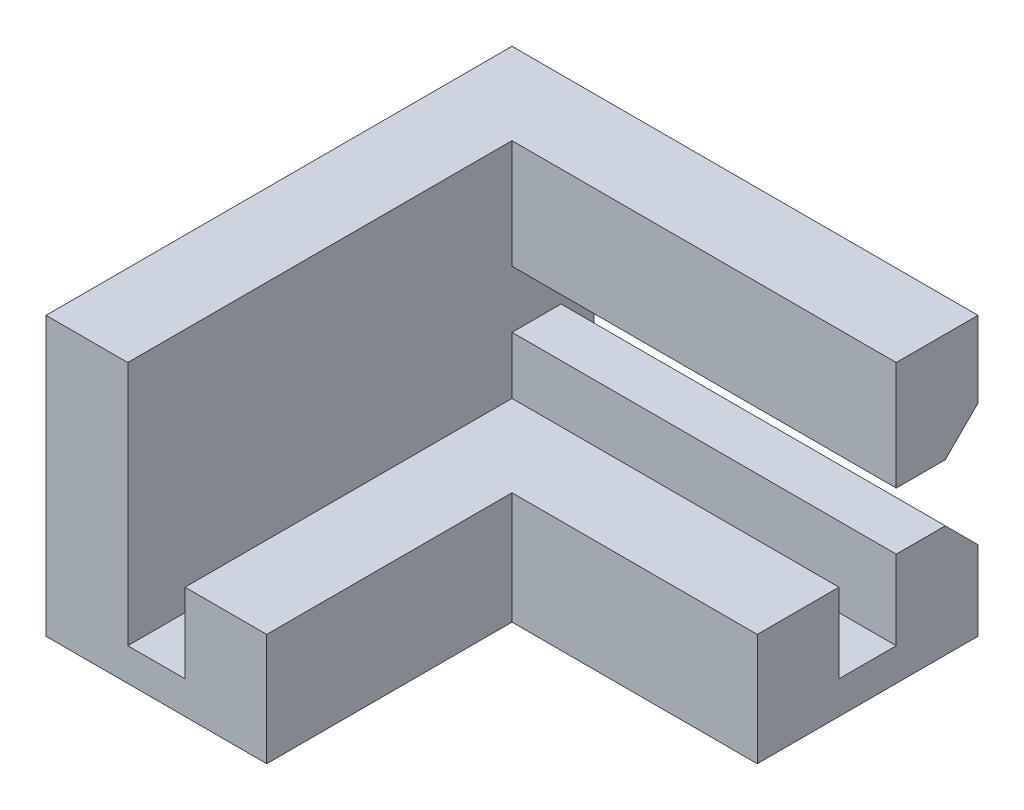
from build123d import *

# Parameters (mm, degrees)
BOSS_EXTRUDE1_DEPTH     = 15
BOSS_EXTRUDE2_DEPTH     = 2
CUT_EXTRUDE1_DEPTH      = 10.15
CUT_EXTRUDE2_DEPTH      = 4.85
CUT_EXTRUDE5_DEPTH      = 37.462309307
CUT_EXTRUDE5_DEPTH_BACK = 37.462309307
CHAMFER3_SIZE           = 2
CUT_EXTRUDE6_DEPTH      = 60.299036748
CUT_EXTRUDE6_DEPTH_BACK = 60.299036748
SKETCH6_W               = 39.703071578
SKETCH6_H               = 42.363425718


with BuildPart() as part:
    # Sketch1 → Boss-Extrude1 (new body)
    with BuildSketch(Plane(origin=(0, 0, 0), x_dir=(1, 0, 0), z_dir=(0, 1, 0))):
        Polygon((23.5, 9.391735838), (-5, 9.391735838), (-5, -4.108264162), (10, -4.108264162), (10, -19.108264162), (23.5, -19.108264162), align=None)
        Polygon((0, 4.391735838), (0, 0.891735838), (15, 0.891735838), (15, -14.108264162), (18.5, -14.108264162), (18.5, 4.391735838), align=None, mode=Mode.SUBTRACT)
    extrude(amount=BOSS_EXTRUDE1_DEPTH)

    # Sketch2 → Boss-Extrude2 (add)
    with BuildSketch(Plane.XZ):
        Polygon((-5, 4.108264162), (10, 4.108264162), (10, 19.108264162), (23.5, 19.108264162), (23.5, -9.391735838), (-5, -9.391735838), align=None)
    extrude(amount=BOSS_EXTRUDE2_DEPTH)

    # Sketch3 → Cut-Extrude1 (cut)
    with BuildSketch(Plane(origin=(0, 15, 0), x_dir=(1, 0, 0), z_dir=(0, 1, 0))):
        Polygon((18.5, 4.391735838), (-5, 4.391735838), (-5, 0.891735838), (-5, -4.108264162), (10, -4.108264162), (10, -19.108264162), (15, -19.108264162), (18.5, -19.108264162), align=None)
    extrude(amount=-CUT_EXTRUDE1_DEPTH, mode=Mode.SUBTRACT)

    # Sketch4 → Cut-Extrude2 (cut)
    with BuildSketch(Plane(origin=(0, 4.85, 0), x_dir=(1, 0, 0), z_dir=(0, 1, 0))):
        Polygon((-5, 4.391735838), (18.5, 4.391735838), (18.5, -19.108264162), (15, -19.108264162), (15, 0.891735838), (-5, 0.891735838), align=None)
    extrude(amount=-CUT_EXTRUDE2_DEPTH, mode=Mode.SUBTRACT)

    # Sketch5 → Cut-Extrude5 (cut, two sides: drawn at the far end of the back side and taken through both)
    with BuildSketch(Plane.XY.offset(-4.391735838).offset(-CUT_EXTRUDE5_DEPTH_BACK)):
        Polygon((-5, 4.85), (18.5, 4.85), (18.5, 8.35), (-10.741212184, 8.35), (-10.741212184, 4.85), align=None)
    extrude(amount=CUT_EXTRUDE5_DEPTH + CUT_EXTRUDE5_DEPTH_BACK, mode=Mode.SUBTRACT)

    # Chamfer3
    chamfer3_edges = [part.edges().sort_by_distance(p)[0] for p in [
        (6.75, 8.35, -9.391735838),
        (6.75, 4.85, -9.391735838),
    ]]
    chamfer(chamfer3_edges, length=CHAMFER3_SIZE)


with BuildPart() as body_2:
    # Mirror1: mirrored copy
    add(part.part.mirror(Plane.ZY.offset(15)))


with BuildPart() as part_1:
    add(part.part)

    # Sketch6 → Cut-Extrude6 (cut, two sides: drawn at the far end of the back side and taken through both)
    with BuildSketch(Plane(origin=(0, 15, 0), x_dir=(1, 0, 0), z_dir=(0, 1, 0)).offset(-CUT_EXTRUDE6_DEPTH_BACK)):
        with Locations((10, -4.108264162)):
            Rectangle(SKETCH6_W, SKETCH6_H)
    extrude(amount=CUT_EXTRUDE6_DEPTH + CUT_EXTRUDE6_DEPTH_BACK, mode=Mode.SUBTRACT)


solid = body_2.part
